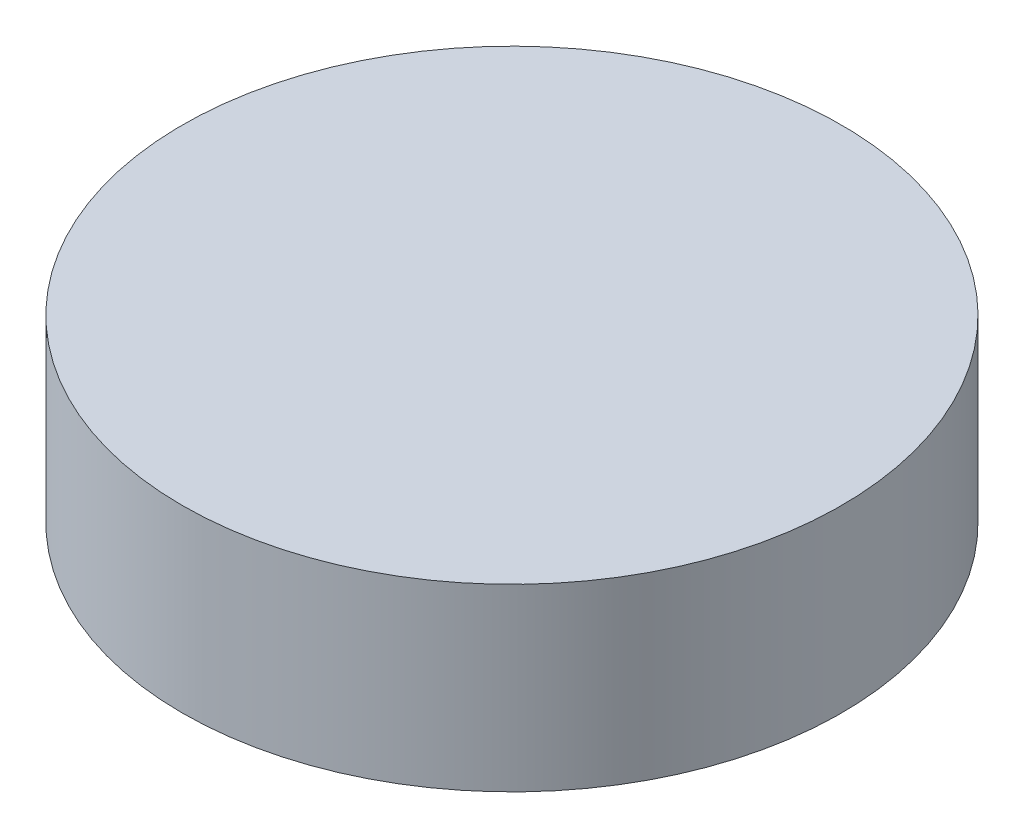
from build123d import *

# Parameters (mm, degrees)
SKETCH1_R           = 27.5
BOSS_EXTRUDE1_DEPTH = 15


with BuildPart() as part:
    # Sketch1 → Boss-Extrude1 (new body)
    with BuildSketch(Plane(origin=(0, 0, 0), x_dir=(1, 0, 0), z_dir=(0, 1, 0))):
        with Locations(Location((0, 0, 0), (0, 0, 270))):
            Circle(SKETCH1_R)
    extrude(amount=BOSS_EXTRUDE1_DEPTH)


solid = part.part
